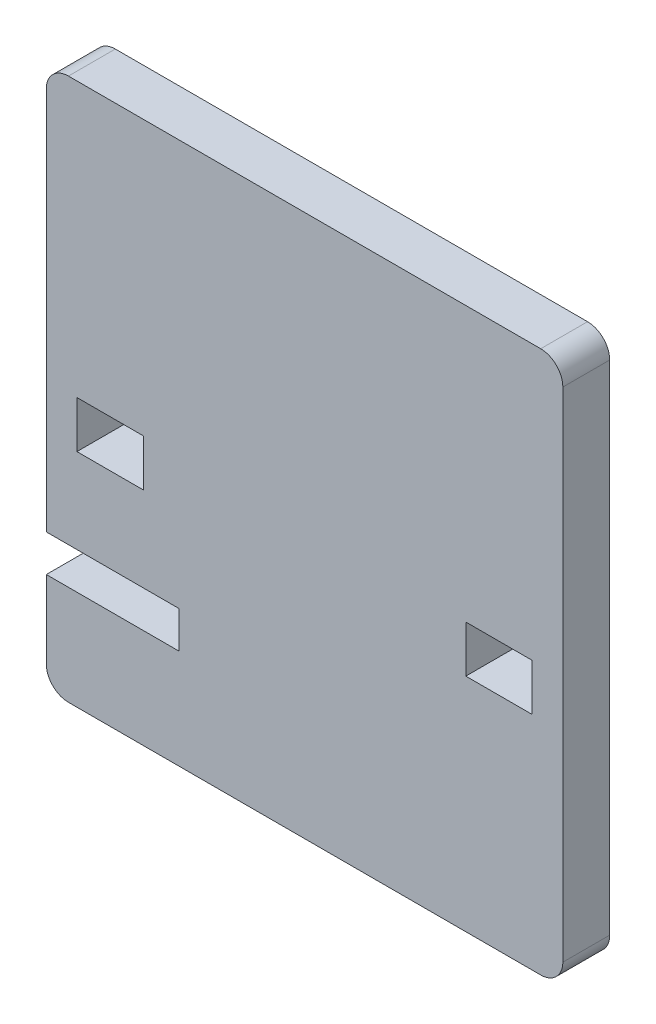
from build123d import *

# Parameters (mm, degrees)
SKETCH1_W           = 70
SKETCH1_H           = 73.5
BOSS_EXTRUDE1_DEPTH = 6.35
SKETCH2_W           = 9
SKETCH2_H           = 6.35
SKETCH2_W_2         = 17.9920326
SKETCH2_H_2         = 5
CUT_EXTRUDE1_DEPTH  = 6.35
FILLET1_R           = 3


with BuildPart() as part:
    # Sketch1 → Boss-Extrude1 (new body)
    with BuildSketch(Plane.XY):
        Rectangle(SKETCH1_W, SKETCH1_H)
    extrude(amount=BOSS_EXTRUDE1_DEPTH)

    # Sketch2 → Cut-Extrude1 (cut)
    with BuildSketch(Plane.XY.offset(6.35)):
        with Locations((-26.35, -3.575)):
            Rectangle(SKETCH2_W, SKETCH2_H)
        with Locations((-26.0039837, -20.75)):
            Rectangle(SKETCH2_W_2, SKETCH2_H_2)
        with Locations((26.35, -3.575)):
            Rectangle(SKETCH2_W, SKETCH2_H)
    extrude(amount=-CUT_EXTRUDE1_DEPTH, mode=Mode.SUBTRACT)

    # Fillet1
    fillet1_edges = [part.edges().sort_by_distance(p)[0] for p in [
        (35, -36.75, 3.175),
        (-35, -36.75, 3.175),
        (-35, 36.75, 3.175),
        (35, 36.75, 3.175),
    ]]
    fillet(fillet1_edges, radius=FILLET1_R)


solid = part.part
